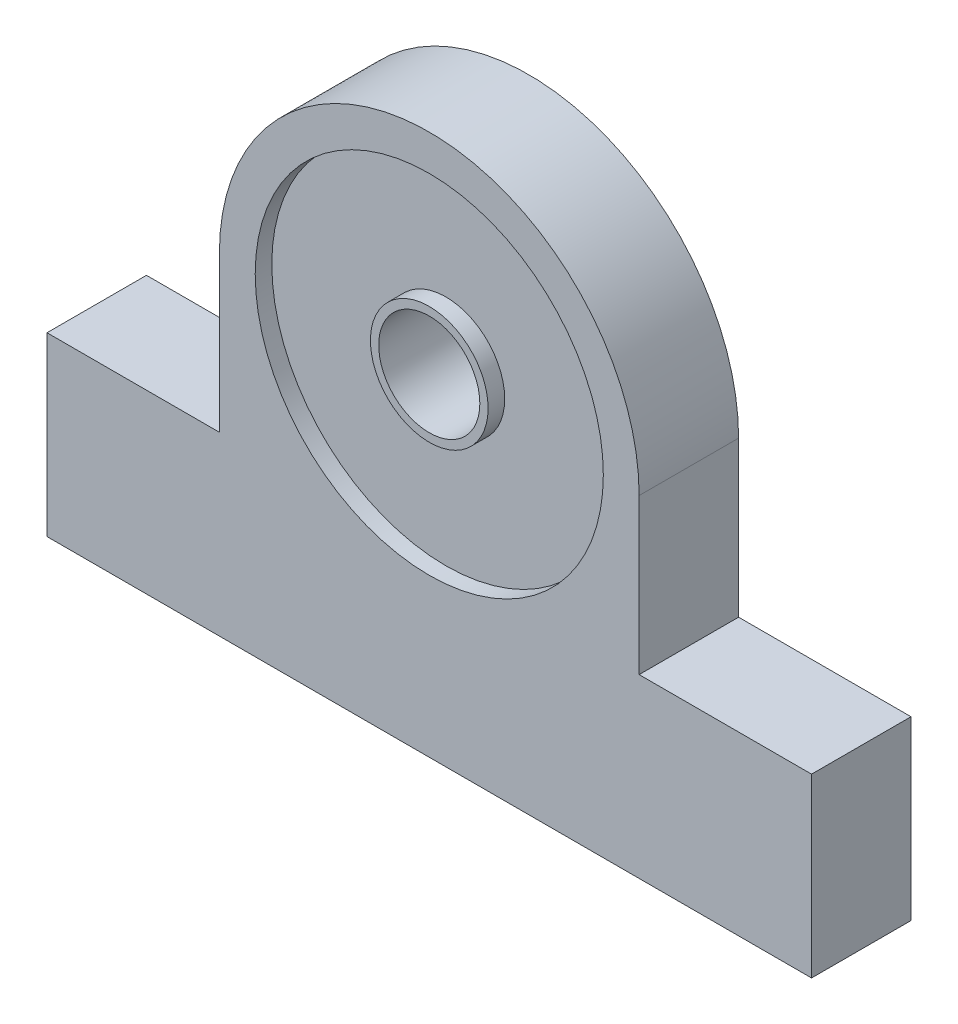
from build123d import *

# Parameters (mm, degrees)
SKETCH1_R            = 11
SKETCH1_R_2          = 3
BOSS_EXTRUDE2_DEPTH  = 6
SKETCH3_R            = 10.5
CUT_EXTRUDE1_DEPTH   = 1
SKETCH4_R            = 3.55
BOSS_EXTRUDE5_DEPTH  = 1
SKETCH5_R            = 3.05
CUT_EXTRUDE2_DEPTH   = 17.673332001
BOSS_EXTRUDE6_START  = 2
SKETCH6_R            = 3.55
BOSS_EXTRUDE6_DEPTH  = 2
SKETCH7_R            = 3.05
CUT_EXTRUDE3_DEPTH   = 18.492855685
SKETCH9_R            = 11
BOSS_EXTRUDE9_DEPTH  = 6
SKETCH10_W           = 46.121208306
SKETCH10_H           = 4.65
BOSS_EXTRUDE10_DEPTH = 6


with BuildPart() as part:
    # Sketch1 → Boss-Extrude2 (new body)
    with BuildSketch(Plane.XY):
        Circle(SKETCH1_R)
        Circle(SKETCH1_R_2, mode=Mode.SUBTRACT)
    extrude(amount=BOSS_EXTRUDE2_DEPTH)

    # Sketch3 → Cut-Extrude1 (cut)
    with BuildSketch(Plane.XY.offset(6)):
        Circle(SKETCH3_R)
    extrude(amount=-CUT_EXTRUDE1_DEPTH, mode=Mode.SUBTRACT)

    # Sketch4 → Boss-Extrude5 (add)
    with BuildSketch(Plane.XY.offset(5)):
        Circle(SKETCH4_R)
    extrude(amount=BOSS_EXTRUDE5_DEPTH)

    # Sketch5 → Cut-Extrude2 (cut, through all)
    with BuildSketch(Plane.XY.offset(6)):
        Circle(SKETCH5_R)
    extrude(amount=-CUT_EXTRUDE2_DEPTH, mode=Mode.SUBTRACT)

    # Sketch6 → Boss-Extrude6 (add)
    with BuildSketch(Plane(origin=(0, 0, 0), x_dir=(-1, 0, 0), z_dir=(0, 0, -1)).offset(BOSS_EXTRUDE6_START)):
        with Locations(Location((0, 0, 0), (0, 0, 180))):
            Circle(SKETCH6_R)
    extrude(amount=-BOSS_EXTRUDE6_DEPTH)

    # Sketch7 → Cut-Extrude3 (cut, through all)
    with BuildSketch(Plane(origin=(0, 0, -2), x_dir=(-1, 0, 0), z_dir=(0, 0, -1))):
        with Locations(Location((0, 0, 0), (0, 0, 180))):
            Circle(SKETCH7_R)
    extrude(amount=-CUT_EXTRUDE3_DEPTH, mode=Mode.SUBTRACT)

    # Sketch9 → Boss-Extrude9 (add, through all)
    with BuildSketch(Plane.XY):
        with BuildLine():
            Line((-12.660604153, 0), (-12.660604153, -9.354915786))
            Line((-12.660604153, -9.354915786), (-23.060604153, -9.354915786))
            Line((-23.060604153, -9.354915786), (-23.060604153, -15.354915786))
            Line((-23.060604153, -15.354915786), (23.060604153, -15.354915786))
            Line((23.060604153, -15.354915786), (23.060604153, -9.354915786))
            Line((23.060604153, -9.354915786), (12.660604153, -9.354915786))
            Line((12.660604153, -9.354915786), (12.660604153, 0))
            ThreePointArc((12.660604153, 0), (0, 12.660604153), (-12.660604153, 0))
        make_face()
        Circle(SKETCH9_R, mode=Mode.SUBTRACT)
    extrude(amount=BOSS_EXTRUDE9_DEPTH)

    # Sketch10 → Boss-Extrude10 (add)
    with BuildSketch(Plane.XY):
        with Locations((0, -17.679915786)):
            Rectangle(SKETCH10_W, SKETCH10_H)
    extrude(amount=BOSS_EXTRUDE10_DEPTH)


solid = part.part
